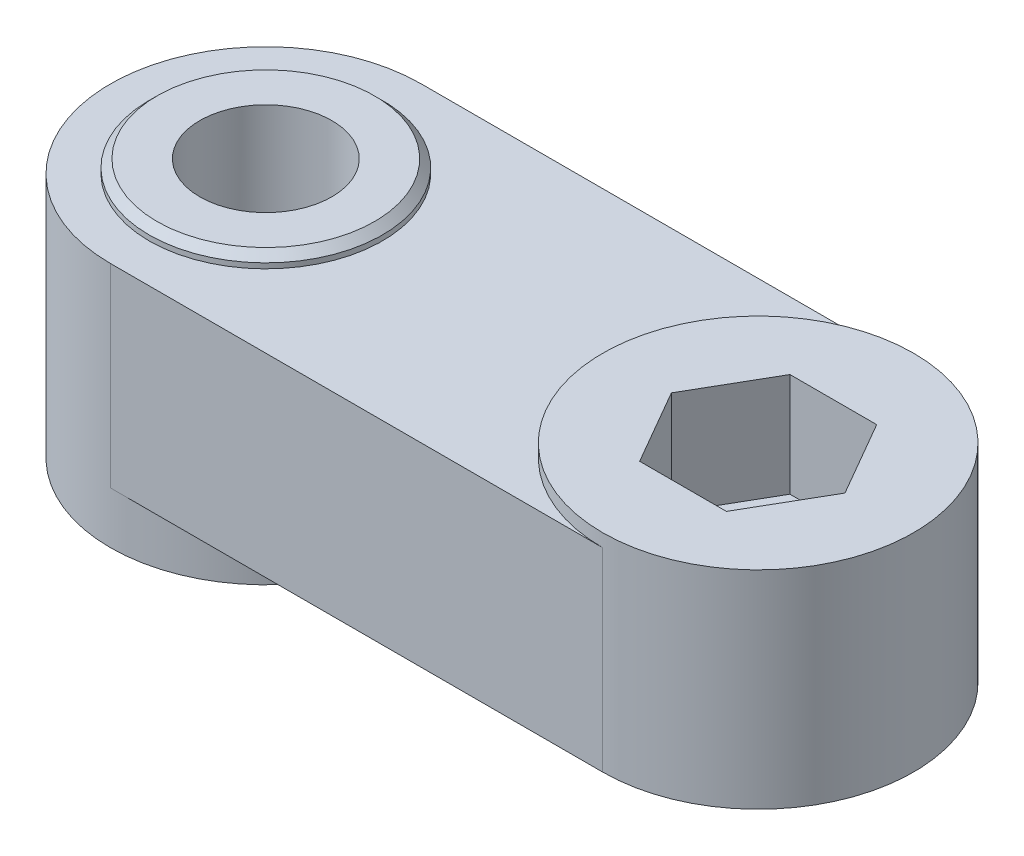
from build123d import *

# Parameters (mm, degrees)
EXTRUDE_1_DEPTH     = 10
CUT_EXTRUDE_1_DEPTH = 5
SKETCH_6_R          = 27.317981471
SKETCH_6_R_2        = 6
CUT_EXTRUDE_2_DEPTH = 2
CUT_EXTRUDE_3_DEPTH = 4
CUT_EXTRUDE_START   = -0.5
SKETCH_8_W          = 36.274656105
SKETCH_8_H          = 16.774008436
SKETCH_8_R          = 6
CUT_EXTRUDE_4_DEPTH = 0.5
SKETCH_9_R          = 6
SKETCH_9_R_2        = 4.5
CUT_EXTRUDE_5_DEPTH = 0.5
CHAMFER_1_SIZE      = 0.3


with BuildPart() as part:
    # 草图1 → 凸台-拉伸1 (new body)
    with BuildSketch(Plane(origin=(0, 0, 0), x_dir=(1, 0, 0), z_dir=(0, 1, 0))):
        with BuildLine():
            Line((0, 6), (19, 6))
            ThreePointArc((19, 6), (25, 0), (19, -6))
            Line((19, -6), (0, -6))
            ThreePointArc((0, -6), (-6, 0), (0, 6))
        make_face()
    extrude(amount=EXTRUDE_1_DEPTH)

    # 草图3 → 切除-旋转2 (revolve, cut)
    with BuildSketch(Plane.XY, mode=Mode.PRIVATE) as cut_revolve_2_sk:
        Polygon((0, 10), (-2.55, 10), (-2.55, 5), (-2.1, 5), (-2.1, 2), (-2.55, 2), (-2.55, 0), (0, 0), align=None)
    revolve(cut_revolve_2_sk.sketch.rotate(Axis((0, 10, 0), (0, -1, 0)), 270), axis=Axis((0, 10, 0), (0, -1, 0)), mode=Mode.SUBTRACT)

    # 草图4 → 切除-旋转3 (revolve, cut)
    with BuildSketch(Plane.XY, mode=Mode.PRIVATE) as cut_revolve_3_sk:
        Polygon((19, 10), (16.5, 10), (16.5, 5), (16.925, 5), (16.925, 0), (19, 0), align=None)
    revolve(cut_revolve_3_sk.sketch.rotate(Axis((19, 10, 0), (0, -1, 0)), 270), axis=Axis((19, 10, 0), (0, -1, 0)), mode=Mode.SUBTRACT)

    # 草图5 → 切除-拉伸1 (cut)
    with BuildSketch(Plane.XZ):
        Polygon((-4.214656965, 0), (-2.107328483, -3.65), (2.107328483, -3.65), (4.214656965, 0), (2.107328483, 3.65), (-2.107328483, 3.65), align=None)
    extrude(amount=-CUT_EXTRUDE_1_DEPTH, mode=Mode.SUBTRACT)

    # 草图6 → 切除-拉伸2 (cut)
    with BuildSketch(Plane.XZ):
        Circle(SKETCH_6_R)
        with Locations(Location((0, 0, 0), (0, 0, 90))):
            Circle(SKETCH_6_R_2, mode=Mode.SUBTRACT)
    extrude(amount=-CUT_EXTRUDE_2_DEPTH, mode=Mode.SUBTRACT)

    # 草图7 → 切除-拉伸3 (cut)
    with BuildSketch(Plane(origin=(0, 10, 0), x_dir=(1, 0, 0), z_dir=(0, 1, 0))):
        Polygon((17.325684219, 2.9), (15.651368439, 0), (17.325684219, -2.9), (20.674315781, -2.9), (22.348631561, 0), (20.674315781, 2.9), align=None)
    extrude(amount=-CUT_EXTRUDE_3_DEPTH, mode=Mode.SUBTRACT)

    # 草图8 → 切除-拉伸4 (cut)
    with BuildSketch(Plane(origin=(0, 10, 0), x_dir=(1, 0, 0), z_dir=(0, 1, 0)).offset(CUT_EXTRUDE_START)):
        with Locations((9.154855794, 0.069028841)):
            Rectangle(SKETCH_8_W, SKETCH_8_H)
        with Locations(Location((0, 0, 0), (0, 0, 270))):
            Circle(SKETCH_8_R, mode=Mode.SUBTRACT)
        with Locations(Location((19, 0, 0), (0, 0, 270))):
            Circle(SKETCH_8_R, mode=Mode.SUBTRACT)
    extrude(amount=CUT_EXTRUDE_4_DEPTH, mode=Mode.SUBTRACT)

    # 草图9 → 切除-拉伸5 (cut)
    with BuildSketch(Plane(origin=(0, 10, 0), x_dir=(1, 0, 0), z_dir=(0, 1, 0)).offset(CUT_EXTRUDE_START)):
        with Locations(Location((0, 0, 0), (0, 0, 270))):
            Circle(SKETCH_9_R)
        with Locations(Location((0, 0, 0), (0, 0, 270))):
            Circle(SKETCH_9_R_2, mode=Mode.SUBTRACT)
    extrude(amount=CUT_EXTRUDE_5_DEPTH, mode=Mode.SUBTRACT)

    # 倒角1
    chamfer_1_edges = [part.edges().sort_by_distance(p)[0] for p in [
        (0, 10, -4.5),
    ]]
    chamfer(chamfer_1_edges, length=CHAMFER_1_SIZE)


solid = part.part
